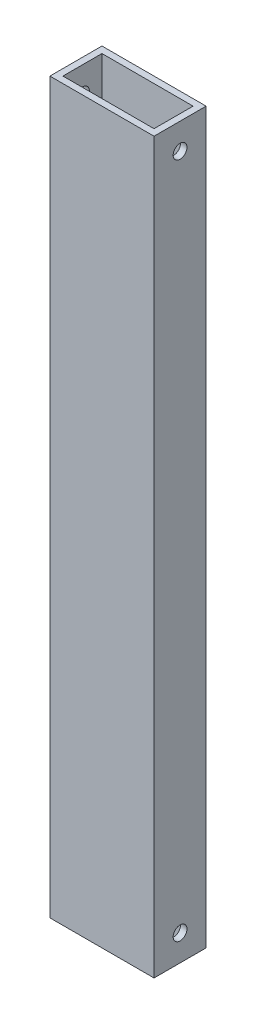
from build123d import *

# Parameters (mm, degrees)
SKETCH1_W           = 50.8
SKETCH1_H           = 25.4
SKETCH1_W_2         = 44.45
SKETCH1_H_2         = 19.05
BOSS_EXTRUDE1_DEPTH = 355.6
SKETCH2_R           = 3.3734375
CUT_EXTRUDE1_DEPTH  = 361.10715072


with BuildPart() as part:
    # Sketch1 → Boss-Extrude1 (new body)
    with BuildSketch(Plane(origin=(0, 0, 0), x_dir=(1, 0, 0), z_dir=(0, 1, 0))):
        with Locations((25.4, 12.7)):
            Rectangle(SKETCH1_W, SKETCH1_H)
        with Locations((25.4, 12.7)):
            Rectangle(SKETCH1_W_2, SKETCH1_H_2, mode=Mode.SUBTRACT)
    extrude(amount=BOSS_EXTRUDE1_DEPTH)

    # Sketch2 → Cut-Extrude1 (cut, through all)
    with BuildSketch(Plane(origin=(50.8, 0, 0), x_dir=(0, 0, -1), z_dir=(1, 0, 0))):
        with Locations((12.7, 12.7)):
            Circle(SKETCH2_R)
    cut_extrude1 = extrude(amount=-CUT_EXTRUDE1_DEPTH, mode=Mode.SUBTRACT)

    # Mirror1: Cut-Extrude1 across plane
    add(cut_extrude1.mirror(Plane.ZX.offset(177.8)), mode=Mode.SUBTRACT)


solid = part.part
